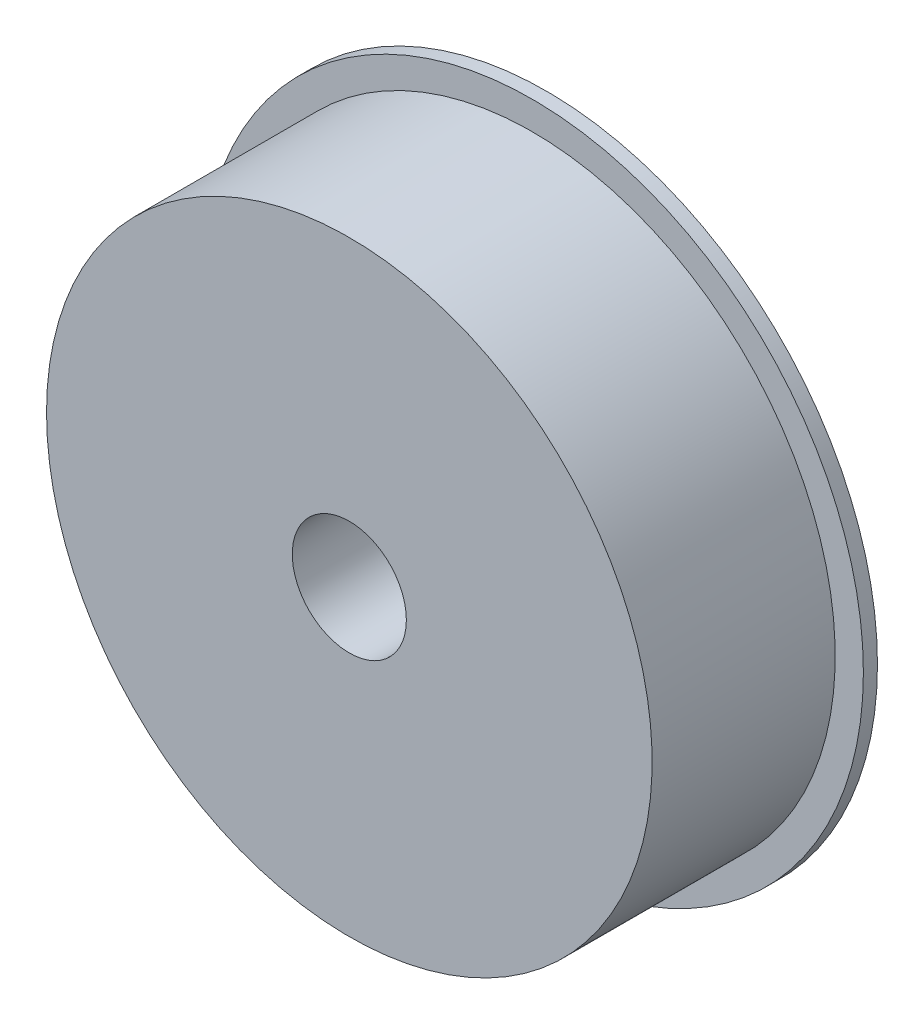
from build123d import *

# Parameters (mm, degrees)
CROQUIS1_R              = 23.5
SALIENTE_EXTRUIR1_DEPTH = 0.5
CROQUIS2_R              = 21.5
SALIENTE_EXTRUIR2_DEPTH = 13
CROQUIS3_R              = 4.05
CORTAR_EXTRUIR1_DEPTH   = 40


with BuildPart() as part:
    # Croquis1 → Saliente-Extruir1 (new, symmetric)
    with BuildSketch(Plane.XY):
        Circle(CROQUIS1_R)
    extrude(amount=SALIENTE_EXTRUIR1_DEPTH, both=True)

    # Croquis2 → Saliente-Extruir2 (add)
    with BuildSketch(Plane.XY.offset(0.5)):
        with Locations(Location((0, 0, 0), (0, 0, 180))):
            Circle(CROQUIS2_R)
    extrude(amount=SALIENTE_EXTRUIR2_DEPTH)

    # Croquis3 → Cortar-Extruir1 (cut)
    with BuildSketch(Plane.XY.offset(13.5)):
        Circle(CROQUIS3_R)
    extrude(amount=-CORTAR_EXTRUIR1_DEPTH, mode=Mode.SUBTRACT)


solid = part.part
